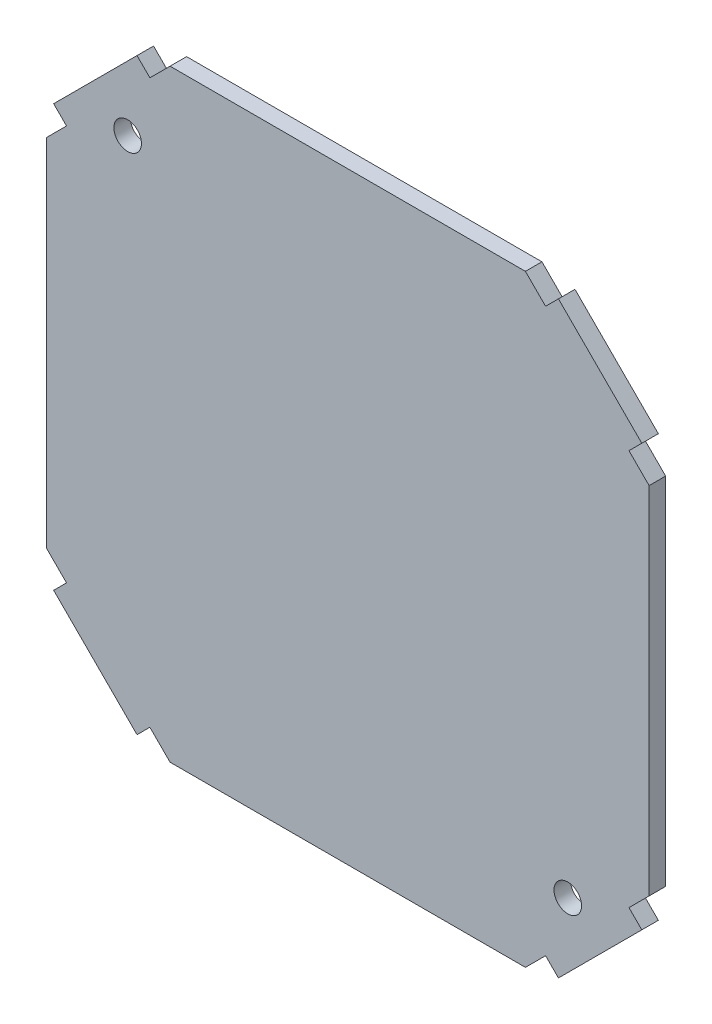
from build123d import *

# Parameters (mm, degrees)
ESQUISSE1_R        = 2.5
BOSS_EXTRU_1_DEPTH = 3


with BuildPart() as part:
    # Esquisse1 → Boss.-Extru.1 (new body)
    with BuildSketch(Plane.XY.offset(3)):
        Polygon((83.180673727, 37.513816477), (68.04858861, 52.645901594), (65.715136232, 50.312449216), (62.055338257, 53.972247191), (-2.441299609, 53.972247191), (-6.101097584, 50.312449216), (-8.434549962, 52.645901594), (-23.566635079, 37.513816477), (-21.233182701, 35.180364099), (-24.892980676, 31.520566124), (-24.892980676, -32.976071742), (-21.233182701, -36.635869717), (-23.566635079, -38.969322095), (-8.434549962, -54.101407212), (-6.101097584, -51.767954834), (-2.441299609, -55.427752809), (62.055338257, -55.427752809), (65.715136232, -51.767954834), (68.04858861, -54.101407212), (83.180673727, -38.969322095), (80.847221349, -36.635869717), (84.507019324, -32.976071742), (84.507019324, 31.520566124), (80.847221349, 35.180364099), align=None)
        with Locations((-10.131606237, 39.210872752)):
            Circle(ESQUISSE1_R, mode=Mode.SUBTRACT)
        with Locations((69.745644885, -40.66637837)):
            Circle(ESQUISSE1_R, mode=Mode.SUBTRACT)
    extrude(amount=-BOSS_EXTRU_1_DEPTH)


solid = part.part
